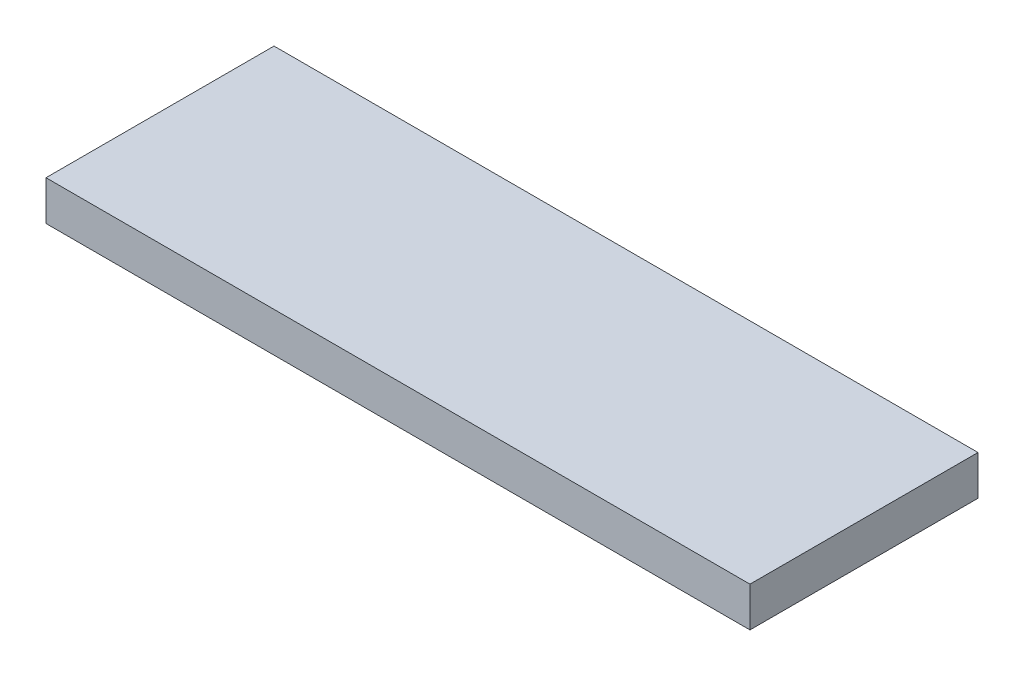
from build123d import *

# Parameters (mm, degrees)
SKETCH1_W           = 35.5
SKETCH1_H           = 11.5
BOSS_EXTRUDE1_DEPTH = 2
SCALE1_SCALE        = 10


with BuildPart() as part:
    # Sketch1 → Boss-Extrude1 (new body)
    with BuildSketch(Plane(origin=(0, 0, 0), x_dir=(1, 0, 0), z_dir=(0, 1, 0))):
        with Locations((-12.138221154, -1.962740385)):
            Rectangle(SKETCH1_W, SKETCH1_H)
    extrude(amount=BOSS_EXTRUDE1_DEPTH)


with BuildPart() as part_1:
    # Scale1: scaled about (-12.138221154, 1, 1.962740385)
    add(part.part.scale(SCALE1_SCALE).moved(Location((109.243990386, -9, -17.664663465))))


solid = part_1.part
